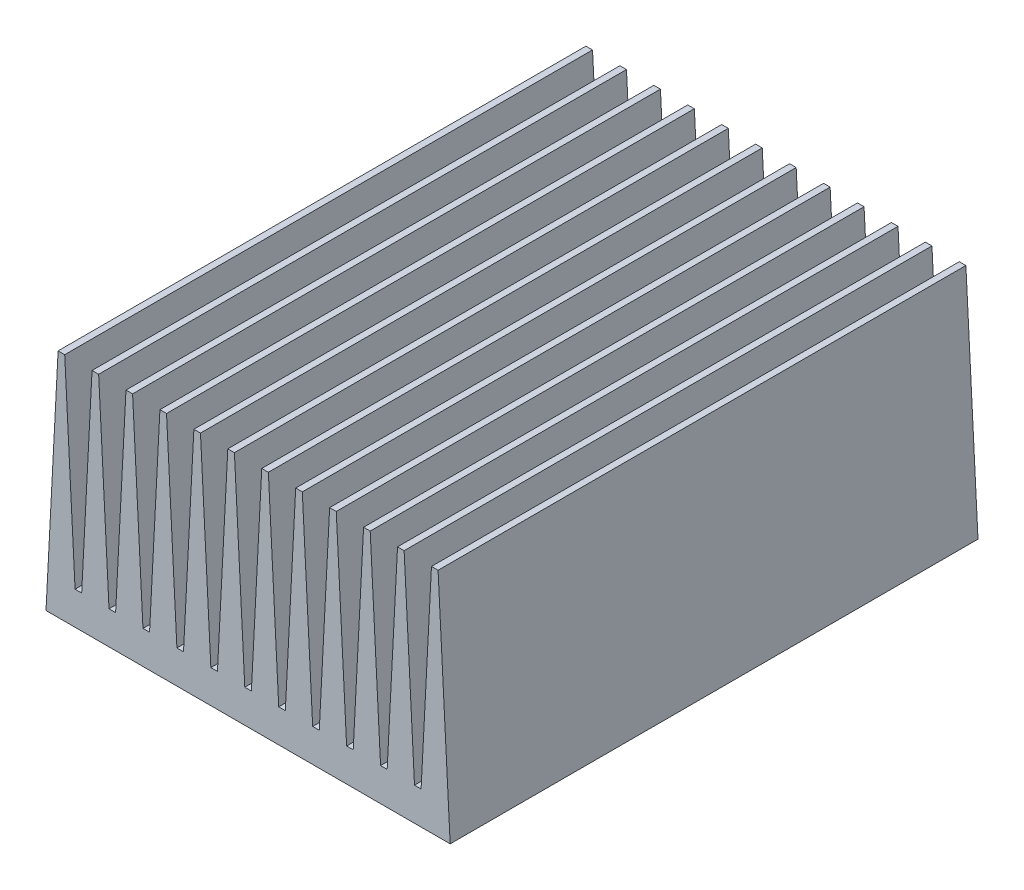
from build123d import *

# Parameters (mm, degrees)
BOSS_EXTRUDE1_DEPTH = 80


with BuildPart() as part:
    # Sketch3 → Boss-Extrude1 (new body)
    with BuildSketch(Plane.XY):
        Polygon((0, 5), (0.5, 5), (2.072233378, 35), (3.072233378, 35), (4.644466757, 5), (5.644466757, 5), (7.216700135, 35), (8.216700135, 35), (9.788933514, 5), (10.788933514, 5), (12.361166892, 35), (13.361166892, 35), (14.933400271, 5), (15.933400271, 5), (17.505633649, 35), (18.505633649, 35), (20.077867028, 5), (21.077867028, 5), (22.650100406, 35), (23.650100406, 35), (25.222333785, 5), (26.222333785, 5), (27.794567163, 35), (28.794567163, 35), (30.366800542, 5), (30.628839438, 0), (5.644466757, 0), (0, 0), align=None)
    boss_extrude1 = extrude(amount=-BOSS_EXTRUDE1_DEPTH)

    # Mirror1: Boss-Extrude1 across plane
    add(boss_extrude1.mirror(Plane(origin=(0, 0, 0), x_dir=(0, 0, 1), z_dir=(1, 0, 0))))


solid = part.part
